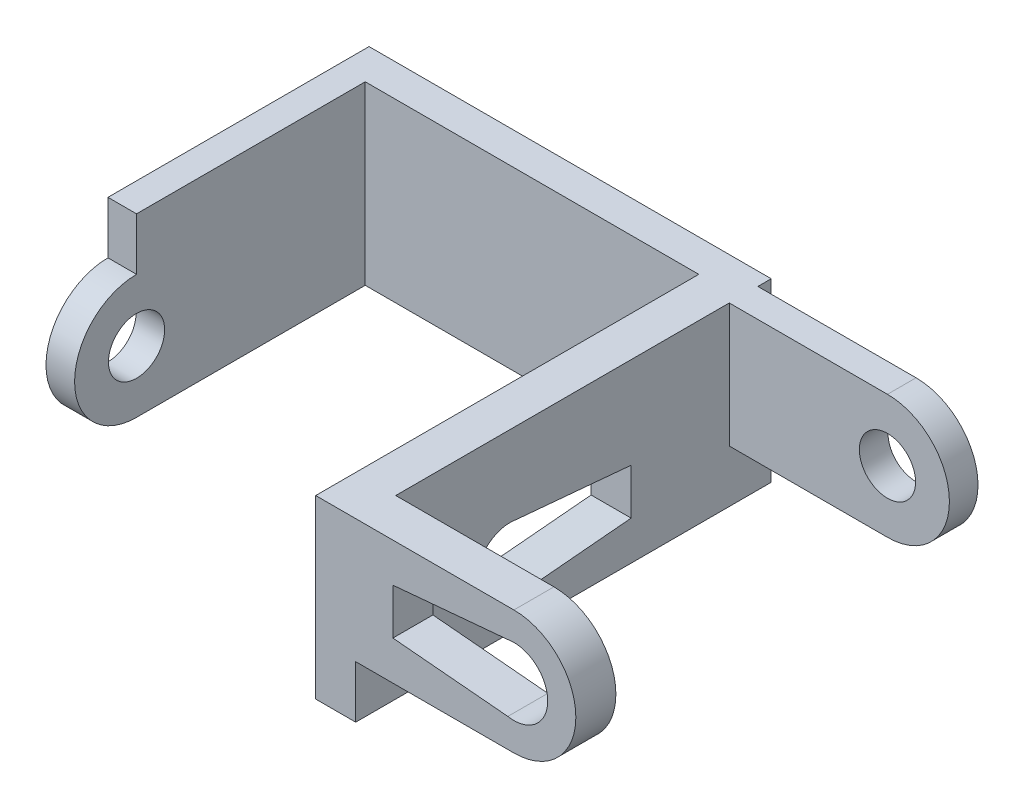
from build123d import *

# Parameters (mm, degrees)
BOSS_EXTRUDE1_START = -34.9
SKETCH1_W           = 43.6
SKETCH1_H           = 18.5
BOSS_EXTRUDE1_DEPTH = 2.1
CUT_EXTRUDE1_START  = -34.9
SKETCH2_R           = 3.55
CUT_EXTRUDE1_DEPTH  = 2.1
CUT_EXTRUDE2_START  = -34.9
CUT_EXTRUDE2_DEPTH  = 2.1
BOSS_EXTRUDE2_START = 14.1
SKETCH4_R           = 6.5
BOSS_EXTRUDE2_DEPTH = 2.1
BOSS_EXTRUDE3_START = 14.1
SKETCH5_W           = 20.8
SKETCH5_H           = 13
BOSS_EXTRUDE3_DEPTH = 2.1
CUT_EXTRUDE3_START  = 14.1
SKETCH6_R           = 3.55
CUT_EXTRUDE3_DEPTH  = 2.1
CUT_EXTRUDE4_START  = 14.1
CUT_EXTRUDE4_DEPTH  = 2.1
BOSS_EXTRUDE4_START = -24.5
SKETCH8_R           = 6.5
BOSS_EXTRUDE4_DEPTH = 1.5
BOSS_EXTRUDE5_START = -24.5
SKETCH9_W           = 20.8
SKETCH9_H           = 13
BOSS_EXTRUDE5_DEPTH = 1.5
CUT_EXTRUDE5_START  = -24.5
SKETCH10_R          = 2.95
CUT_EXTRUDE5_DEPTH  = 1.5
BOSS_EXTRUDE6_START = -25.7
SKETCH11_W          = 42.2
SKETCH11_H          = 18.5
BOSS_EXTRUDE6_DEPTH = 1.7
BOSS_EXTRUDE7_START = -73.5
SKETCH12_R          = 6.5
BOSS_EXTRUDE7_DEPTH = 1.5
BOSS_EXTRUDE8_START = -73.5
SKETCH13_W          = 27.4
SKETCH13_H          = 18.5
BOSS_EXTRUDE8_DEPTH = 1.5
CUT_EXTRUDE6_START  = -73.5
SKETCH14_R          = 2.95
CUT_EXTRUDE6_DEPTH  = 1.5


with BuildPart() as part:
    # Sketch1 → Boss-Extrude1 (new, symmetric)
    with BuildSketch(Plane(origin=(0, 0, 0), x_dir=(0, 0, -1), z_dir=(1, 0, 0)).offset(BOSS_EXTRUDE1_START)):
        with Locations((5.6, -21.25)):
            Rectangle(SKETCH1_W, SKETCH1_H)
    extrude(amount=BOSS_EXTRUDE1_DEPTH, both=True)

    # Sketch2 → Cut-Extrude1 (cut, symmetric)
    with BuildSketch(Plane(origin=(0, 0, 0), x_dir=(0, 0, -1), z_dir=(1, 0, 0)).offset(CUT_EXTRUDE1_START)):
        with Locations((0, -24)):
            Circle(SKETCH2_R)
    extrude(amount=CUT_EXTRUDE1_DEPTH, both=True, mode=Mode.SUBTRACT)

    # Sketch3 → Cut-Extrude2 (cut, symmetric)
    with BuildSketch(Plane(origin=(0, 0, 0), x_dir=(0, 0, -1), z_dir=(1, 0, 0)).offset(CUT_EXTRUDE2_START)):
        Polygon((0, -20.45), (12.7, -21.596718595), (12.7, -26.403281405), (0, -27.55), align=None)
    extrude(amount=CUT_EXTRUDE2_DEPTH, both=True, mode=Mode.SUBTRACT)



with BuildPart() as body_2:
    # Sketch4 → Boss-Extrude2 (new, symmetric)
    with BuildSketch(Plane.XY.offset(BOSS_EXTRUDE2_START)):
        with Locations((-16.2, -18.5)):
            Circle(SKETCH4_R)
    extrude(amount=BOSS_EXTRUDE2_DEPTH, both=True)


with BuildPart() as part_1:
    add(part.part)

    add(body_2.part)  # Boss-Extrude3 merges body 2
    # Sketch5 → Boss-Extrude3 (add, symmetric)
    with BuildSketch(Plane.XY.offset(BOSS_EXTRUDE3_START)):
        with Locations((-26.6, -18.5)):
            Rectangle(SKETCH5_W, SKETCH5_H)
    extrude(amount=BOSS_EXTRUDE3_DEPTH, both=True)

    # Sketch6 → Cut-Extrude3 (cut, symmetric)
    with BuildSketch(Plane.XY.offset(CUT_EXTRUDE3_START)):
        with Locations((-16.2, -18.5)):
            Circle(SKETCH6_R)
    extrude(amount=CUT_EXTRUDE3_DEPTH, both=True, mode=Mode.SUBTRACT)

    # Sketch7 → Cut-Extrude4 (cut, symmetric)
    with BuildSketch(Plane.XY.offset(CUT_EXTRUDE4_START)):
        Polygon((-16.2, -22.05), (-28.9, -20.903281405), (-28.9, -16.096718595), (-16.2, -14.95), align=None)
    extrude(amount=CUT_EXTRUDE4_DEPTH, both=True, mode=Mode.SUBTRACT)



with BuildPart() as body_2_2:
    # Sketch8 → Boss-Extrude4 (new, symmetric)
    with BuildSketch(Plane.XY.offset(BOSS_EXTRUDE4_START)):
        with Locations(Location((-16.2, -18.5, 0), (0, 0, 180))):
            Circle(SKETCH8_R)
    extrude(amount=BOSS_EXTRUDE4_DEPTH, both=True)


with BuildPart() as part_2:
    add(part_1.part)

    add(body_2_2.part)  # Boss-Extrude5 merges body 2 2
    # Sketch9 → Boss-Extrude5 (add, symmetric)
    with BuildSketch(Plane.XY.offset(BOSS_EXTRUDE5_START)):
        with Locations((-26.6, -18.5)):
            Rectangle(SKETCH9_W, SKETCH9_H)
    extrude(amount=BOSS_EXTRUDE5_DEPTH, both=True)

    # Sketch10 → Cut-Extrude5 (cut, symmetric)
    with BuildSketch(Plane.XY.offset(CUT_EXTRUDE5_START)):
        with Locations((-16.2, -18.5)):
            Circle(SKETCH10_R)
    extrude(amount=CUT_EXTRUDE5_DEPTH, both=True, mode=Mode.SUBTRACT)

    # Sketch11 → Boss-Extrude6 (add, symmetric)
    with BuildSketch(Plane.XY.offset(BOSS_EXTRUDE6_START)):
        with Locations((-53.9, -21.25)):
            Rectangle(SKETCH11_W, SKETCH11_H)
    extrude(amount=BOSS_EXTRUDE6_DEPTH, both=True)



with BuildPart() as body_2_3:
    # Sketch12 → Boss-Extrude7 (new, symmetric)
    with BuildSketch(Plane(origin=(0, 0, 0), x_dir=(0, 0, -1), z_dir=(1, 0, 0)).offset(BOSS_EXTRUDE7_START)):
        with Locations((0, -24)):
            Circle(SKETCH12_R)
    extrude(amount=BOSS_EXTRUDE7_DEPTH, both=True)


with BuildPart() as part_3:
    add(part_2.part)

    add(body_2_3.part)  # Boss-Extrude8 merges body 2 3
    # Sketch13 → Boss-Extrude8 (add, symmetric)
    with BuildSketch(Plane(origin=(0, 0, 0), x_dir=(0, 0, -1), z_dir=(1, 0, 0)).offset(BOSS_EXTRUDE8_START)):
        with Locations((13.7, -21.25)):
            Rectangle(SKETCH13_W, SKETCH13_H)
    extrude(amount=BOSS_EXTRUDE8_DEPTH, both=True)

    # Sketch14 → Cut-Extrude6 (cut, symmetric)
    with BuildSketch(Plane(origin=(0, 0, 0), x_dir=(0, 0, -1), z_dir=(1, 0, 0)).offset(CUT_EXTRUDE6_START)):
        with Locations((0, -24)):
            Circle(SKETCH14_R)
    extrude(amount=CUT_EXTRUDE6_DEPTH, both=True, mode=Mode.SUBTRACT)


solid = part_3.part
